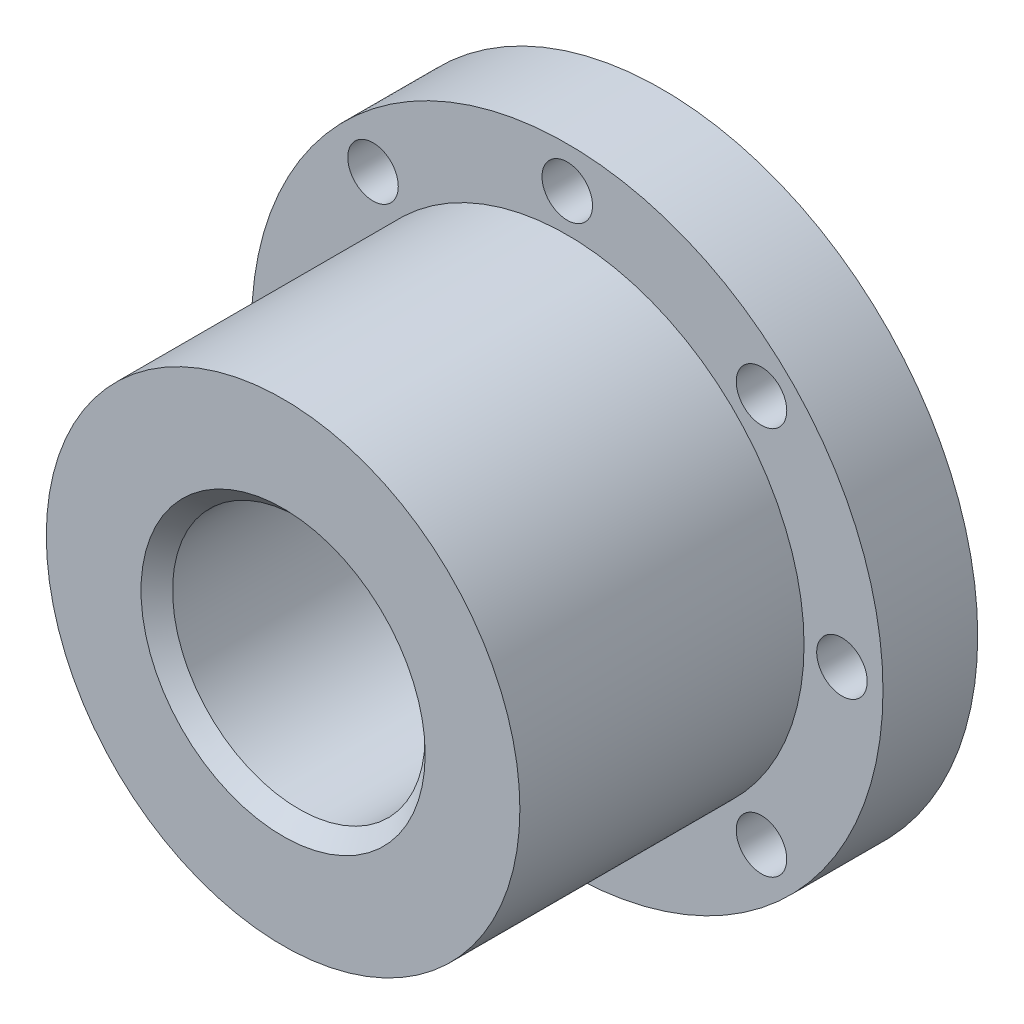
from build123d import *

# Parameters (mm, degrees)
SKETCH_1_R          = 100
EXTRUDE_1_DEPTH     = 30
SKETCH_2_R          = 75
EXTRUDE_2_DEPTH     = 120
SKETCH_3_R          = 40
CUT_EXTRUDE_1_DEPTH = 186.47236991
SKETCH_4_R          = 8
CUT_EXTRUDE_2_DEPTH = 186.47236991
CHAMFER_1_SIZE      = 5


with BuildPart() as part:
    # 草图1 → 凸台-拉伸1 (new body)
    with BuildSketch(Plane.XY):
        Circle(SKETCH_1_R)
    extrude(amount=EXTRUDE_1_DEPTH)

    # 草图2 → 凸台-拉伸2 (add)
    with BuildSketch(Plane.XY):
        Circle(SKETCH_2_R)
    extrude(amount=EXTRUDE_2_DEPTH)

    # 草图3 → 切除-拉伸1 (cut, through all)
    with BuildSketch(Plane.XY):
        Circle(SKETCH_3_R)
    extrude(amount=CUT_EXTRUDE_1_DEPTH, mode=Mode.SUBTRACT)

    # 草图4 → 切除-拉伸2 (cut, through all)
    with BuildSketch(Plane.XY):
        with Locations((87, 0)):
            Circle(SKETCH_4_R)
        with Locations((61.518289963, 61.518289963)):
            Circle(SKETCH_4_R)
        with Locations((0, 87)):
            Circle(SKETCH_4_R)
        with Locations((-61.518289963, 61.518289963)):
            Circle(SKETCH_4_R)
        with Locations((-87, 0)):
            Circle(SKETCH_4_R)
        with Locations((-61.518289963, -61.518289963)):
            Circle(SKETCH_4_R)
        with Locations((0, -87)):
            Circle(SKETCH_4_R)
        with Locations((61.518289963, -61.518289963)):
            Circle(SKETCH_4_R)
    extrude(amount=CUT_EXTRUDE_2_DEPTH, mode=Mode.SUBTRACT)

    # 倒角1
    chamfer_1_edges = [part.edges().sort_by_distance(p)[0] for p in [
        (-40, 0, 120),
    ]]
    chamfer(chamfer_1_edges, length=CHAMFER_1_SIZE)


solid = part.part
